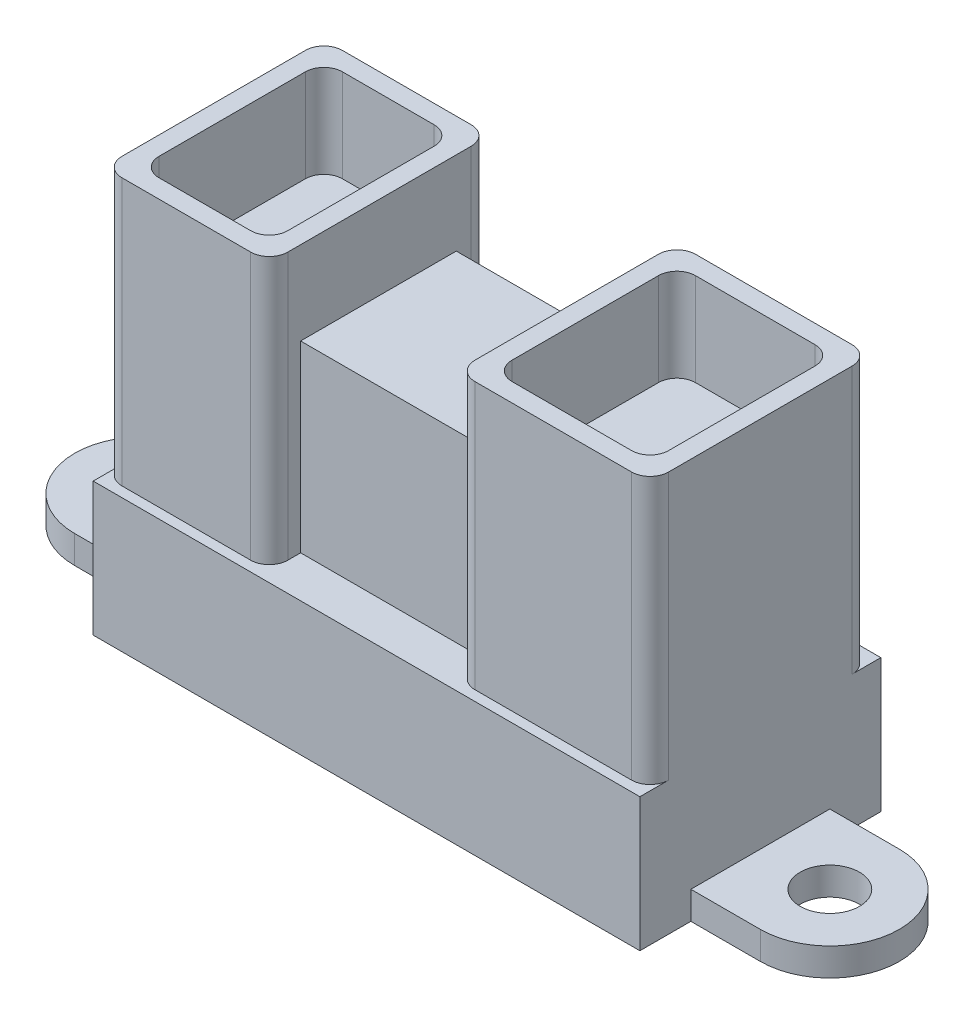
from build123d import *

# Parameters (mm, degrees)
SKETCH3_W           = 29.5
SKETCH3_H           = 13
BOSS_EXTRUDE2_DEPTH = 7.2
SKETCH5_R           = 1.6
BOSS_EXTRUDE3_DEPTH = 1.5
SKETCH9_W           = 8.95
SKETCH9_H           = 11.9
SKETCH9_W_2         = 10.45
BOSS_EXTRUDE4_DEPTH = 14.4
SKETCH10_W          = 10.1
SKETCH10_H          = 8.4
BOSS_EXTRUDE5_DEPTH = 9.9
SKETCH11_W          = 6.95
SKETCH11_H          = 9.9
SKETCH11_W_2        = 8.45
CUT_EXTRUDE2_DEPTH  = 5
FILLET2_R           = 1


with BuildPart() as part:
    # Sketch3 → Boss-Extrude2 (new body)
    with BuildSketch(Plane(origin=(0, 0, 0), x_dir=(1, 0, 0), z_dir=(0, 1, 0))):
        Rectangle(SKETCH3_W, SKETCH3_H)
    extrude(amount=BOSS_EXTRUDE2_DEPTH)

    # Sketch5 → Boss-Extrude3 (add)
    with BuildSketch(Plane(origin=(0, 0, 0), x_dir=(1, 0, 0), z_dir=(0, 1, 0))):
        with BuildLine():
            Line((-18.5, 3.75), (-14.75, 3.75))
            Line((-14.75, 3.75), (-14.75, -3.75))
            Line((-14.75, -3.75), (-18.5, -3.75))
            ThreePointArc((-18.5, -3.75), (-22.25, 0), (-18.5, 3.75))
        make_face()
        with Locations(Location((-18.5, 0, 0), (0, 0, 270))):
            Circle(SKETCH5_R, mode=Mode.SUBTRACT)
    boss_extrude3 = extrude(amount=BOSS_EXTRUDE3_DEPTH)

    # Mirror1: Boss-Extrude3 across plane
    add(boss_extrude3.mirror(Plane(origin=(0, 0, 0), x_dir=(0, 0, 1), z_dir=(1, 0, 0))))

    # Sketch9 → Boss-Extrude4 (add)
    with BuildSketch(Plane(origin=(0, 7.2, 0), x_dir=(1, 0, 0), z_dir=(0, 1, 0))):
        with Locations((-10.275, 0)):
            Rectangle(SKETCH9_W, SKETCH9_H)
        with Locations((9.525, 0)):
            Rectangle(SKETCH9_W_2, SKETCH9_H)
    extrude(amount=BOSS_EXTRUDE4_DEPTH)

    # Sketch10 → Boss-Extrude5 (add)
    with BuildSketch(Plane(origin=(0, 7.2, 0), x_dir=(1, 0, 0), z_dir=(0, 1, 0))):
        with Locations((-0.75, -0.057461808)):
            Rectangle(SKETCH10_W, SKETCH10_H)
    extrude(amount=BOSS_EXTRUDE5_DEPTH)

    # Sketch11 → Cut-Extrude2 (cut)
    with BuildSketch(Plane(origin=(0, 21.6, 0), x_dir=(1, 0, 0), z_dir=(0, 1, 0))):
        with Locations((-10.275, 0)):
            Rectangle(SKETCH11_W, SKETCH11_H)
        with Locations((9.525, 0)):
            Rectangle(SKETCH11_W_2, SKETCH11_H)
    extrude(amount=-CUT_EXTRUDE2_DEPTH, mode=Mode.SUBTRACT)

    # Fillet2
    fillet2_edges = [part.edges().sort_by_distance(p)[0] for p in [
        (-14.75, 14.4, -5.95),
        (-14.75, 14.4, 5.95),
        (-5.8, 14.4, 5.95),
        (-5.8, 14.4, -5.95),
        (14.75, 14.4, 5.95),
        (14.75, 14.4, -5.95),
        (4.3, 14.4, -5.95),
        (4.3, 14.4, 5.95),
        (-13.75, 19.1, 4.95),
        (-13.75, 19.1, -4.95),
        (-6.8, 19.1, -4.95),
        (-6.8, 19.1, 4.95),
        (5.3, 19.1, 4.95),
        (5.3, 19.1, -4.95),
        (13.75, 19.1, -4.95),
        (13.75, 19.1, 4.95),
    ]]
    fillet(fillet2_edges, radius=FILLET2_R)


solid = part.part
